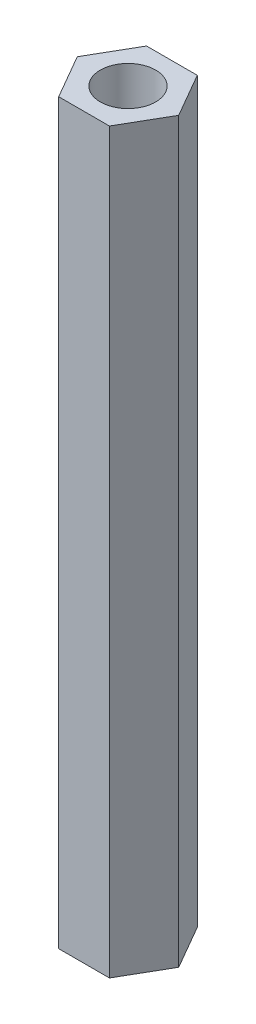
from build123d import *

# Parameters (mm, degrees)
SKETCH1_R           = 1.5
BOSS_EXTRUDE1_DEPTH = 40


with BuildPart() as part:
    # Sketch1 → Boss-Extrude1 (new body)
    with BuildSketch(Plane(origin=(0, 0, 0), x_dir=(1, 0, 0), z_dir=(0, 1, 0))):
        Polygon((2.75, 0), (1.375, 2.38156986), (-1.375, 2.38156986), (-2.75, 0), (-1.375, -2.38156986), (1.375, -2.38156986), align=None)
        with Locations(Location((0, 0, 0), (0, 0, 270))):
            Circle(SKETCH1_R, mode=Mode.SUBTRACT)
    extrude(amount=BOSS_EXTRUDE1_DEPTH)


solid = part.part
